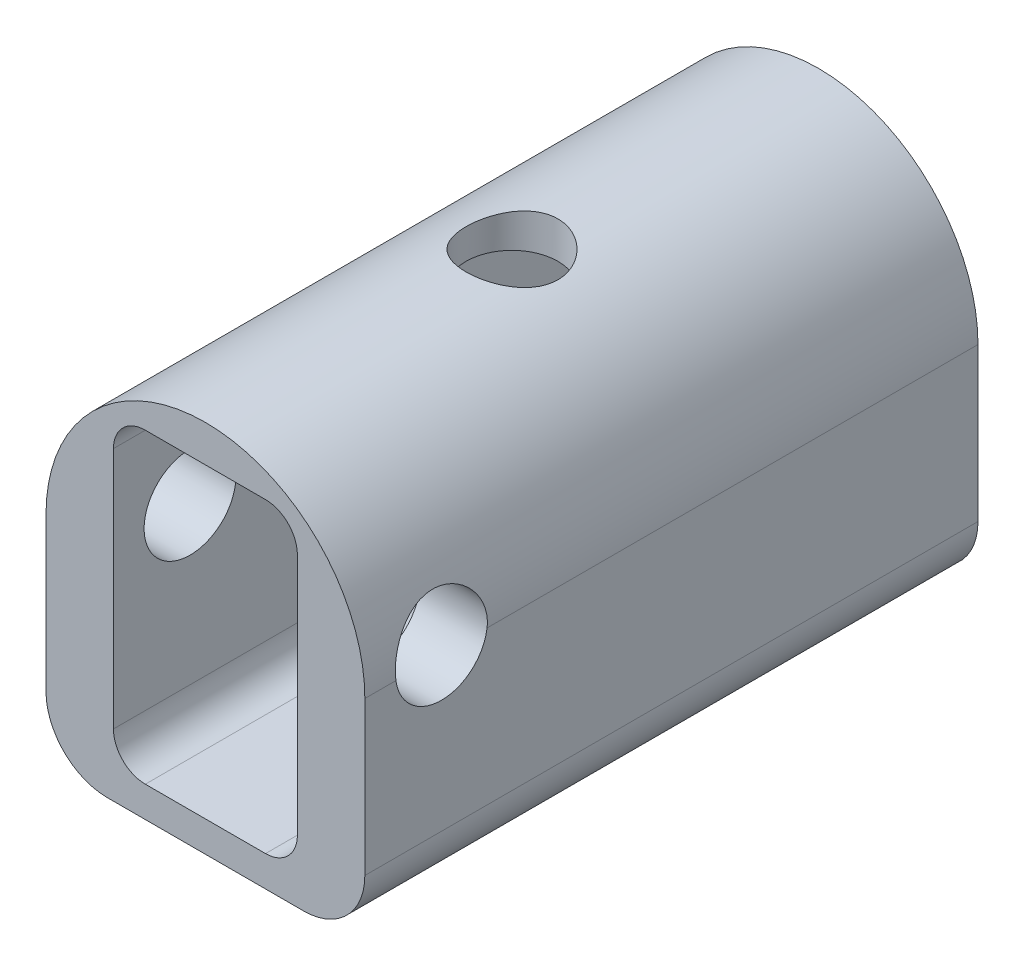
from build123d import *

# Parameters (mm, degrees)
BOSS_EXTRUDE1_DEPTH     = 100
FILLET3_R               = 10
SKETCH2_R               = 7.5
CUT_EXTRUDE1_DEPTH      = 133.680066325
CUT_EXTRUDE5_DEPTH      = 129.160056346
CUT_EXTRUDE5_DEPTH_BACK = 129.160056346
SKETCH3_R               = 7.5


with BuildPart() as part:
    # Sketch1 → Boss-Extrude1 (new body)
    with BuildSketch(Plane.XY):
        with BuildLine():
            Line((0, 35), (0, 0))
            Line((0, 0), (52, 0))
            Line((52, 0), (52, 35))
            ThreePointArc((52, 35), (26, 61), (0, 35))
        make_face()
        with BuildLine():
            Line((11, 49.8), (11, 10.2))
            ThreePointArc((11, 10.2), (12.523044738, 6.523044738), (16.2, 5))
            Line((16.2, 5), (35.8, 5))
            ThreePointArc((35.8, 5), (39.476955262, 6.523044738), (41, 10.2))
            Line((41, 10.2), (41, 49.8))
            ThreePointArc((41, 49.8), (39.476955262, 53.476955262), (35.8, 55))
            Line((35.8, 55), (16.2, 55))
            ThreePointArc((16.2, 55), (12.523044738, 53.476955262), (11, 49.8))
        make_face(mode=Mode.SUBTRACT)
    extrude(amount=BOSS_EXTRUDE1_DEPTH)

    # Fillet3
    fillet3_edges = [part.edges().sort_by_distance(p)[0] for p in [
        (52, 0, 50),
        (0, 0, 50),
    ]]
    fillet(fillet3_edges, radius=FILLET3_R)

    # Sketch2 → Cut-Extrude1 (cut, through all)
    with BuildSketch(Plane(origin=(0, 70, 0), x_dir=(1, 0, 0), z_dir=(0, 1, 0))):
        with Locations(Location((26, -50, 0), (0, 0, 270))):
            Circle(SKETCH2_R)
    extrude(amount=-CUT_EXTRUDE1_DEPTH, mode=Mode.SUBTRACT)

    # Sketch3 → Cut-Extrude5 (cut, two sides: drawn at the far end of the back side and taken through both)
    with BuildSketch(Plane(origin=(0, 0, 0), x_dir=(0, 0, -1), z_dir=(1, 0, 0)).offset(-CUT_EXTRUDE5_DEPTH_BACK)):
        with Locations(Location((-87.5, 36, 0), (0, 0, 352.337744339))):
            Circle(SKETCH3_R)
    extrude(amount=CUT_EXTRUDE5_DEPTH + CUT_EXTRUDE5_DEPTH_BACK, mode=Mode.SUBTRACT)


solid = part.part
